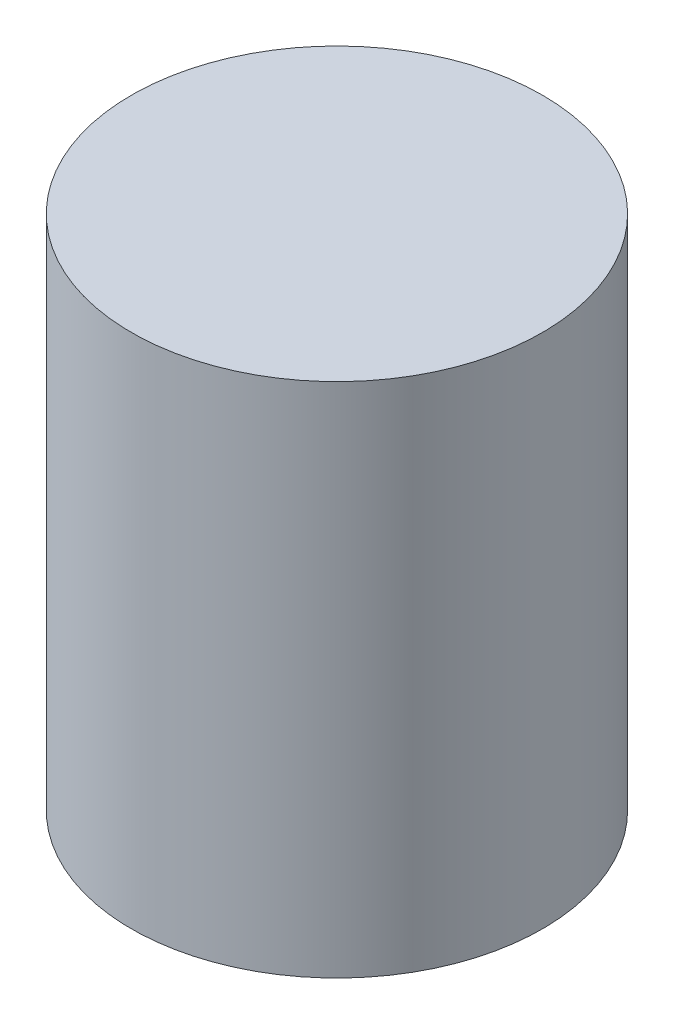
from build123d import *

# Parameters (mm, degrees)
SKETCH1_R           = 43.375767588
BOSS_EXTRUDE1_DEPTH = 109


with BuildPart() as part:
    # Sketch1 → Boss-Extrude1 (new body)
    with BuildSketch(Plane(origin=(0, 0, 0), x_dir=(1, 0, 0), z_dir=(0, 1, 0))):
        with Locations(Location((0, 0, 0), (0, 0, 90))):
            Circle(SKETCH1_R)
    extrude(amount=BOSS_EXTRUDE1_DEPTH)


solid = part.part
